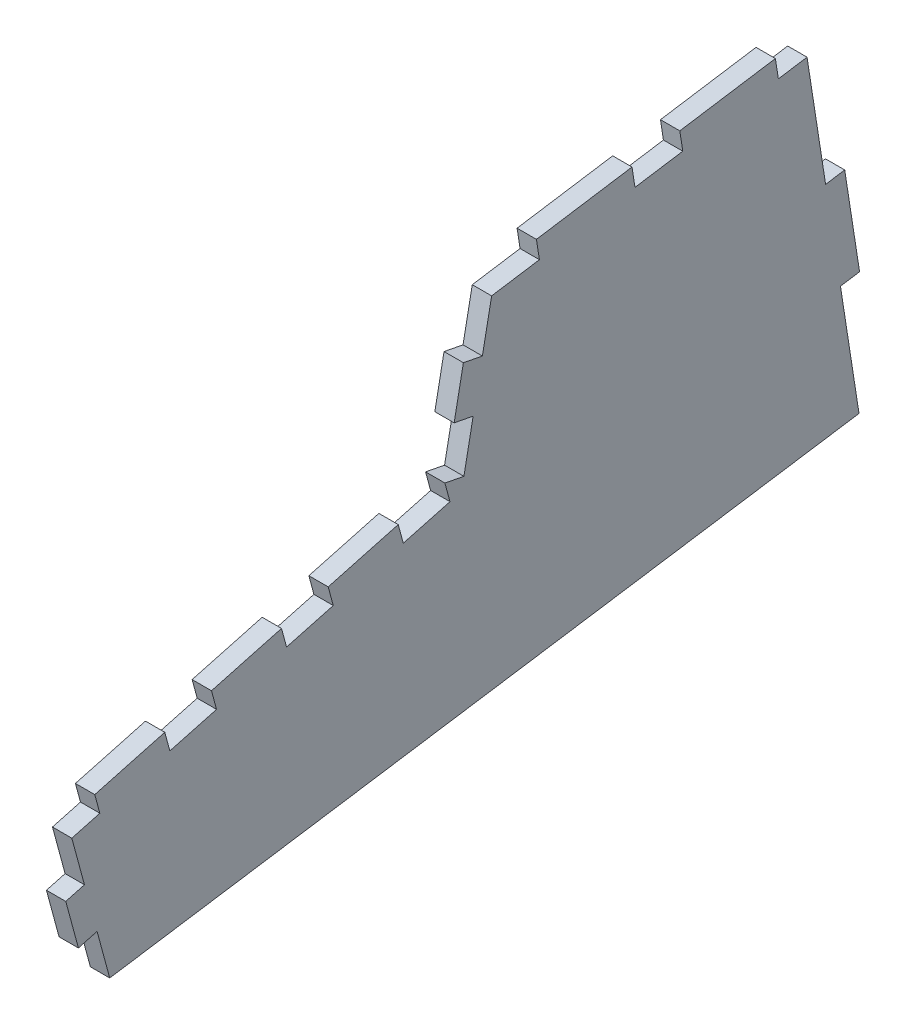
from build123d import *

# Parameters (mm, degrees)
BOSS_EXTRUDE2_DEPTH = 4


with BuildPart() as part:
    # 3DSketch1 → Boss-Extrude2 (new body)
    with BuildSketch(Plane(origin=(-135.319434073, -27.39955072, -28.163146814), x_dir=(-1.1839737659606398e-15, -0.03268810373539661, 0.9994656011460245), z_dir=(-1, 0, 0))):
        Polygon((0, 0), (3.028470594, 24.815889383), (-0.942071707, 25.300444678), (1.480704768, 45.153156184), (5.451247069, 44.668600889), (8.479717663, 69.484490272), (14.435531115, 68.757657329), (14.92008641, 72.728199631), (34.772797916, 70.305423155), (34.288242621, 66.334880854), (44.214598374, 65.123492617), (44.699153669, 69.094034918), (64.551865176, 66.671258443), (64.067309881, 62.700716141), (73.993665634, 61.489327904), (76.223321536, 51.741064748), (80.122626798, 52.632927109), (82.3522827, 42.884663953), (78.452977438, 41.992801592), (80.68263334, 32.244538436), (84.581938602, 33.136400797), (83.663812307, 29.243195934), (93.396824464, 26.947880195), (94.31495076, 30.841085058), (108.914468996, 27.398111451), (107.996342701, 23.504906588), (117.729354858, 21.209590849), (118.647481154, 25.102795712), (133.24699939, 21.659822105), (132.328873095, 17.766617242), (142.061885253, 15.471301504), (142.980011548, 19.364506367), (157.579529784, 15.921532759), (156.661403489, 12.028327896), (162.501210784, 10.651138453), (160.205895045, 0.918126295), (164.099099908, 0), (161.80378417, -9.733012158), (157.910579307, -8.814885862), (155.615263569, -18.54789802), align=None)
    extrude(amount=-BOSS_EXTRUDE2_DEPTH)


solid = part.part
